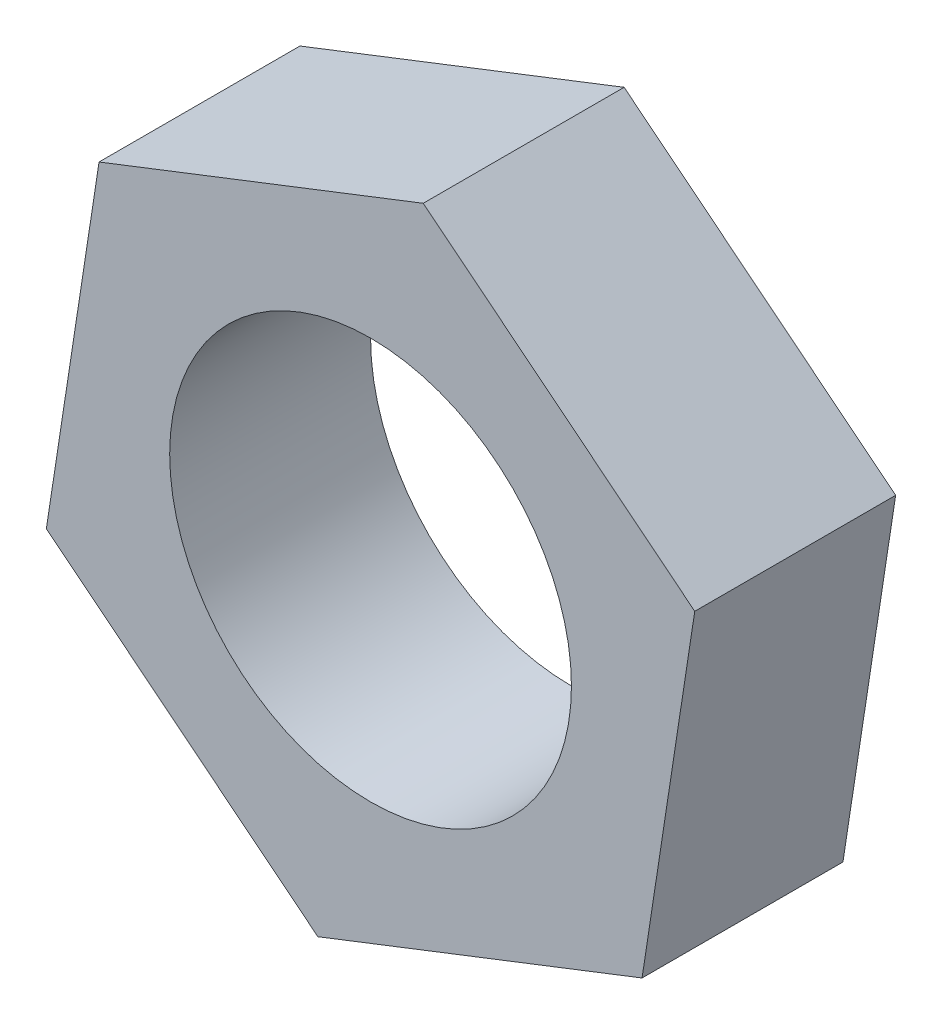
from build123d import *

# Parameters (mm, degrees)
SKETCH2_R           = 1
BOSS_EXTRUDE1_DEPTH = 1


with BuildPart() as part:
    # Sketch2 → Boss-Extrude1 (new body)
    with BuildSketch(Plane.XY):
        Polygon((1.351553788, -1.083190823), (1.613847664, 0.628884504), (0.262293876, 1.712075326), (-1.351553788, 1.083190823), (-1.613847664, -0.628884504), (-0.262293876, -1.712075326), align=None)
        Circle(SKETCH2_R, mode=Mode.SUBTRACT)
    extrude(amount=BOSS_EXTRUDE1_DEPTH)


solid = part.part
